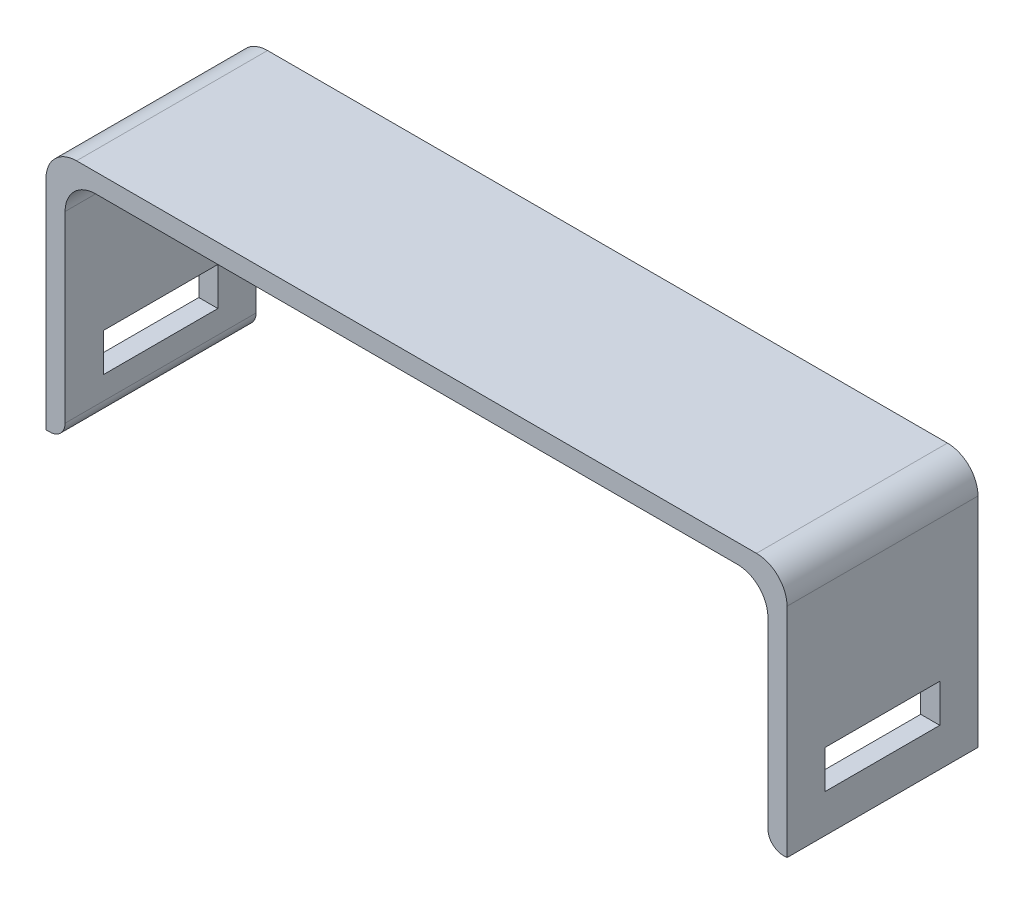
from build123d import *

# Parameters (mm, degrees)
BOSS_EXTRUDE1_DEPTH = 31.75
SKETCH2_W           = 19.05
SKETCH2_H           = 6.35
CUT_EXTRUDE1_DEPTH  = 134.744025007
FILLET1_R           = 5.08
FILLET2_R           = 2.54


with BuildPart() as part:
    # Sketch1 → Boss-Extrude1 (new body)
    with BuildSketch(Plane.XY):
        Polygon((0, 0), (0, 41.275), (123.19, 41.275), (123.19, 0), (120.015, 0), (120.015, 38.1), (3.175, 38.1), (3.175, 0), align=None)
    extrude(amount=BOSS_EXTRUDE1_DEPTH)

    # Sketch2 → Cut-Extrude1 (cut, through all)
    with BuildSketch(Plane.ZY):
        with Locations((15.875, 9.525)):
            Rectangle(SKETCH2_W, SKETCH2_H)
    extrude(amount=-CUT_EXTRUDE1_DEPTH, mode=Mode.SUBTRACT)

    # Fillet1
    fillet1_edges = [part.edges().sort_by_distance(p)[0] for p in [
        (0, 41.275, 15.875),
        (123.19, 41.275, 15.875),
        (120.015, 38.1, 15.875),
        (3.175, 38.1, 15.875),
    ]]
    fillet(fillet1_edges, radius=FILLET1_R)

    # Fillet2
    fillet2_edges = [part.edges().sort_by_distance(p)[0] for p in [
        (120.015, 0, 15.875),
        (3.175, 0, 15.875),
    ]]
    fillet(fillet2_edges, radius=FILLET2_R)


solid = part.part
